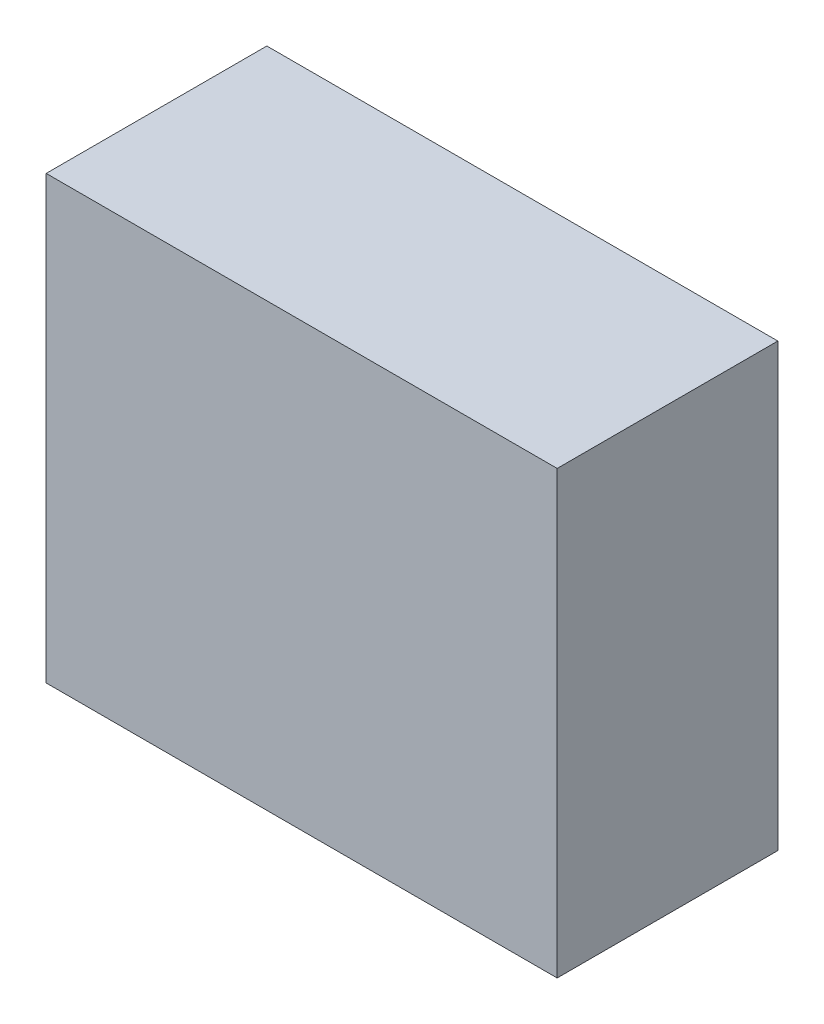
from build123d import *

# Parameters (mm, degrees)
SK_BOX_0_W  = 44
SK_BOX_0_H  = 38
BOX_0_DEPTH = 19


with BuildPart() as part:
    # SK_Box_0 → Box_0 (new body)
    with BuildSketch(Plane.XY.offset(100)):
        with Locations((-24, -61)):
            Rectangle(SK_BOX_0_W, SK_BOX_0_H)
    extrude(amount=BOX_0_DEPTH)


solid = part.part
